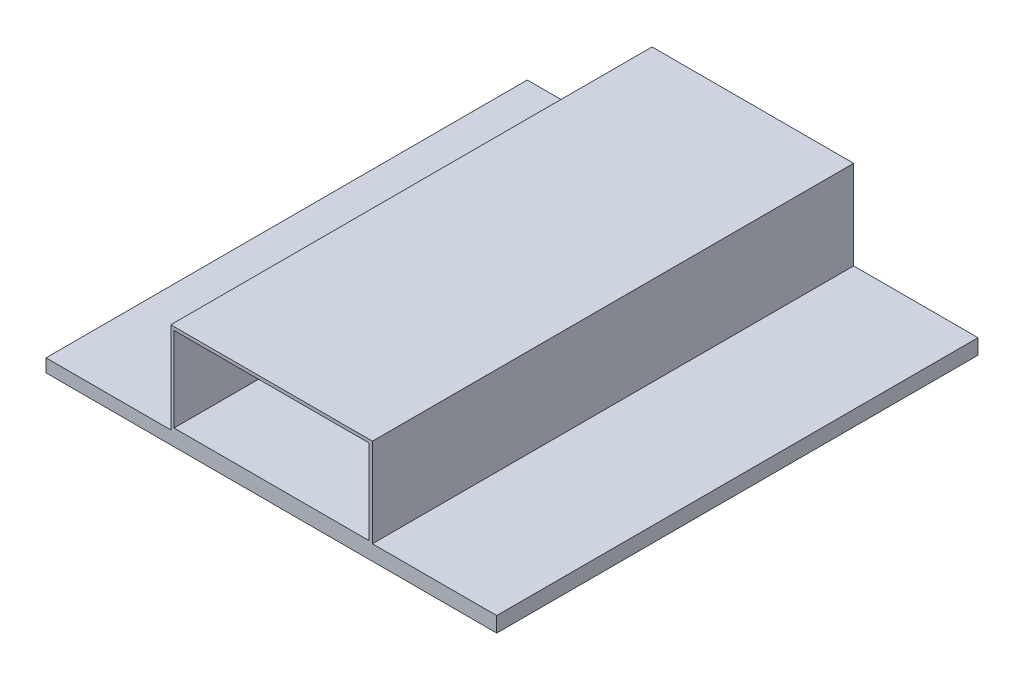
from build123d import *

# Parameters (mm, degrees)
SALIENTE_EXTRUIR1_DEPTH = 74
CROQUIS2_W              = 30
CROQUIS2_H              = 13
CORTAR_EXTRUIR1_DEPTH   = 72


with BuildPart() as part:
    # Croquis1 → Saliente-Extruir1 (new body)
    with BuildSketch(Plane.XY):
        Polygon((-35, -6.5), (-35, -8.5), (34.303847888, -8.5), (34.303847888, -6.162779032), (15.188115151, -6.162779032), (15.188115151, 7.5), (-15.811884849, 7.5), (-15.811884849, -6.5), align=None)
    extrude(amount=SALIENTE_EXTRUIR1_DEPTH)

    # Croquis2 → Cortar-Extruir1 (cut)
    with BuildSketch(Plane.XY.offset(74)):
        with Locations((-0.311884849, 0.5)):
            Rectangle(CROQUIS2_W, CROQUIS2_H)
    extrude(amount=-CORTAR_EXTRUIR1_DEPTH, mode=Mode.SUBTRACT)


solid = part.part
